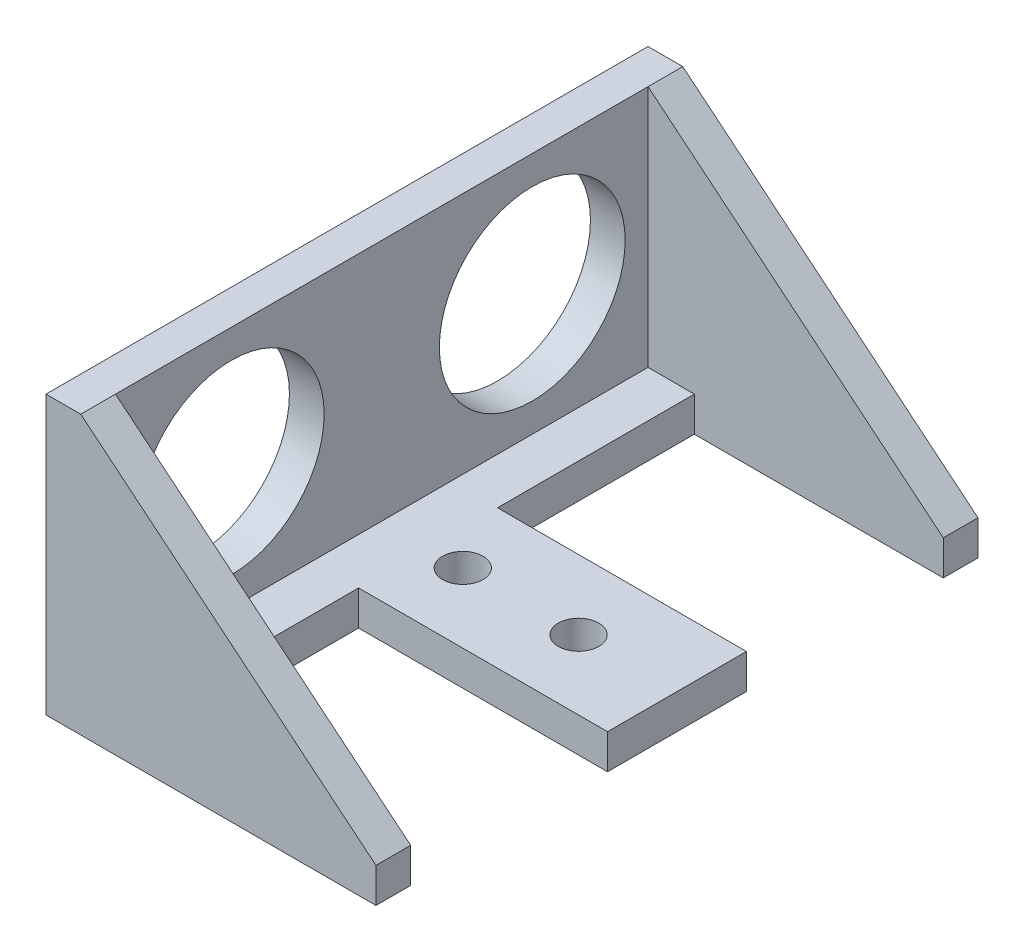
from build123d import *

# Parameters (mm, degrees)
CROQUIS1_W              = 52
CROQUIS1_H              = 21
CROQUIS1_R              = 8.025
SALIENTE_EXTRUIR1_DEPTH = 3
CROQUIS2_W              = 3
CROQUIS2_H              = 21
SALIENTE_EXTRUIR2_DEPTH = 28.5
CORTAR_EXTRUIR1_DEPTH   = 61.815294129
CROQUIS4_R              = 1.75
CORTAR_EXTRUIR2_DEPTH   = 53.671149598
CROQUIS5_W              = 21.5
CROQUIS5_H              = 17
CORTAR_EXTRUIR3_DEPTH   = 53.671149598


with BuildPart() as part:
    # Croquis1 → Saliente-Extruir1 (new body)
    with BuildSketch(Plane(origin=(0, 0, 0), x_dir=(0, 0, -1), z_dir=(1, 0, 0))):
        with Locations((13, 0)):
            Rectangle(CROQUIS1_W, CROQUIS1_H)
        Circle(CROQUIS1_R, mode=Mode.SUBTRACT)
        with Locations((26, 0)):
            Circle(CROQUIS1_R, mode=Mode.SUBTRACT)
    extrude(amount=SALIENTE_EXTRUIR1_DEPTH)

    # Croquis2 → Saliente-Extruir2 (add)
    with BuildSketch(Plane.ZY):
        Polygon((-36, -10.5), (-39, -10.5), (-39, -13.5), (13, -13.5), (13, -10.5), (10, -10.5), align=None)
        with Locations((11.5, 0)):
            Rectangle(CROQUIS2_W, CROQUIS2_H)
        with Locations((-37.5, 0)):
            Rectangle(CROQUIS2_W, CROQUIS2_H)
    extrude(amount=-SALIENTE_EXTRUIR2_DEPTH)

    # Croquis3 → Cortar-Extruir1 (cut, through all)
    with BuildSketch(Plane.XY.offset(13)):
        Polygon((3, 10.5), (28.5, -10.5), (28.5, 10.5), align=None)
    extrude(amount=-CORTAR_EXTRUIR1_DEPTH, mode=Mode.SUBTRACT)

    # Croquis4 → Cortar-Extruir2 (cut, through all)
    with BuildSketch(Plane(origin=(0, -10.5, 0), x_dir=(1, 0, 0), z_dir=(0, 1, 0))):
        with Locations(Location((10, 13, 0), (0, 0, 270))):
            Circle(CROQUIS4_R)
        with Locations(Location((20, 13, 0), (0, 0, 270))):
            Circle(CROQUIS4_R)
    extrude(amount=-CORTAR_EXTRUIR2_DEPTH, mode=Mode.SUBTRACT)

    # Croquis5 → Cortar-Extruir3 (cut, through all)
    with BuildSketch(Plane(origin=(0, -10.5, 0), x_dir=(1, 0, 0), z_dir=(0, 1, 0))):
        with Locations((17.75, 27.5)):
            Rectangle(CROQUIS5_W, CROQUIS5_H)
        with Locations((17.75, -1.5)):
            Rectangle(CROQUIS5_W, CROQUIS5_H)
    extrude(amount=-CORTAR_EXTRUIR3_DEPTH, mode=Mode.SUBTRACT)


solid = part.part
